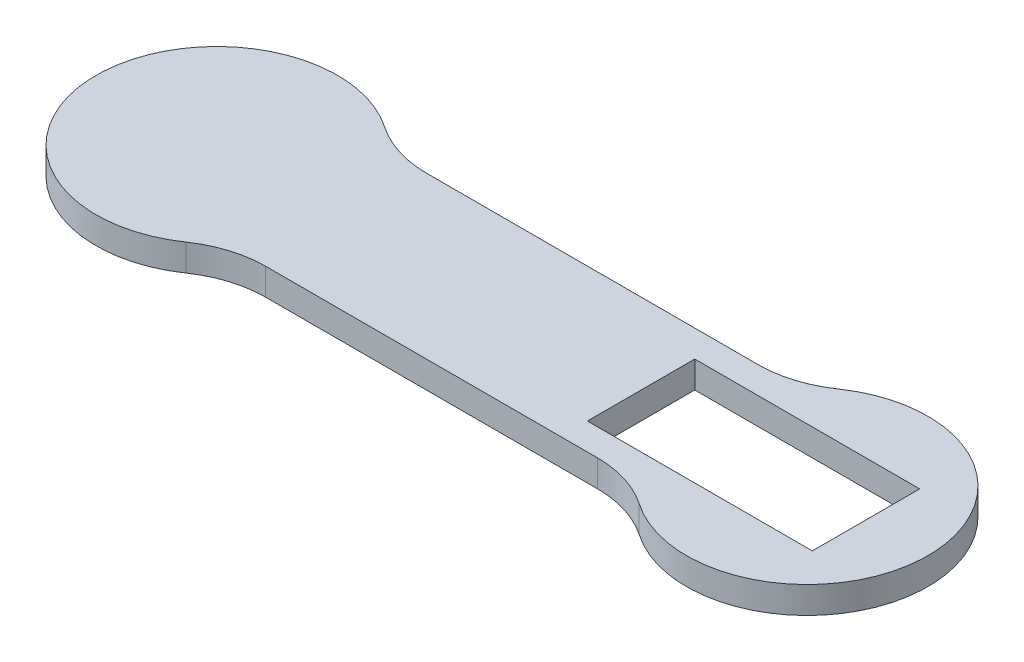
from build123d import *

# Parameters (mm, degrees)
BOSS_EXTRUDE1_DEPTH = 5
SKETCH3_W           = 41.9
SKETCH3_H           = 20
CUT_EXTRUDE1_DEPTH  = 135.489776563


with BuildPart() as part:
    # Sketch2 → Boss-Extrude1 (new body)
    with BuildSketch(Plane(origin=(0, 0, 0), x_dir=(1, 0, 0), z_dir=(0, 1, 0))):
        with BuildLine():
            Line((24.109126902, 15), (85.890873098, 15))
            ThreePointArc((85.890873098, 15), (91.831758355, 15.902725787), (97.236344581, 18.529411765))
            ThreePointArc((97.236344581, 18.529411765), (132.5, 0), (97.236344581, -18.529411765))
            ThreePointArc((97.236344581, -18.529411765), (91.831758355, -15.902725787), (85.890873098, -15))
            Line((85.890873098, -15), (24.109126902, -15))
            ThreePointArc((24.109126902, -15), (18.168241645, -15.902725787), (12.763655419, -18.529411765))
            ThreePointArc((12.763655419, -18.529411765), (-22.5, 0), (12.763655419, 18.529411765))
            ThreePointArc((12.763655419, 18.529411765), (18.168241645, 15.902725787), (24.109126902, 15))
        make_face()
    extrude(amount=BOSS_EXTRUDE1_DEPTH)

    # Sketch3 → Cut-Extrude1 (cut, through all)
    with BuildSketch(Plane(origin=(0, 5, 0), x_dir=(1, 0, 0), z_dir=(0, 1, 0))):
        with Locations((100, 0)):
            Rectangle(SKETCH3_W, SKETCH3_H)
    extrude(amount=-CUT_EXTRUDE1_DEPTH, mode=Mode.SUBTRACT)


solid = part.part
